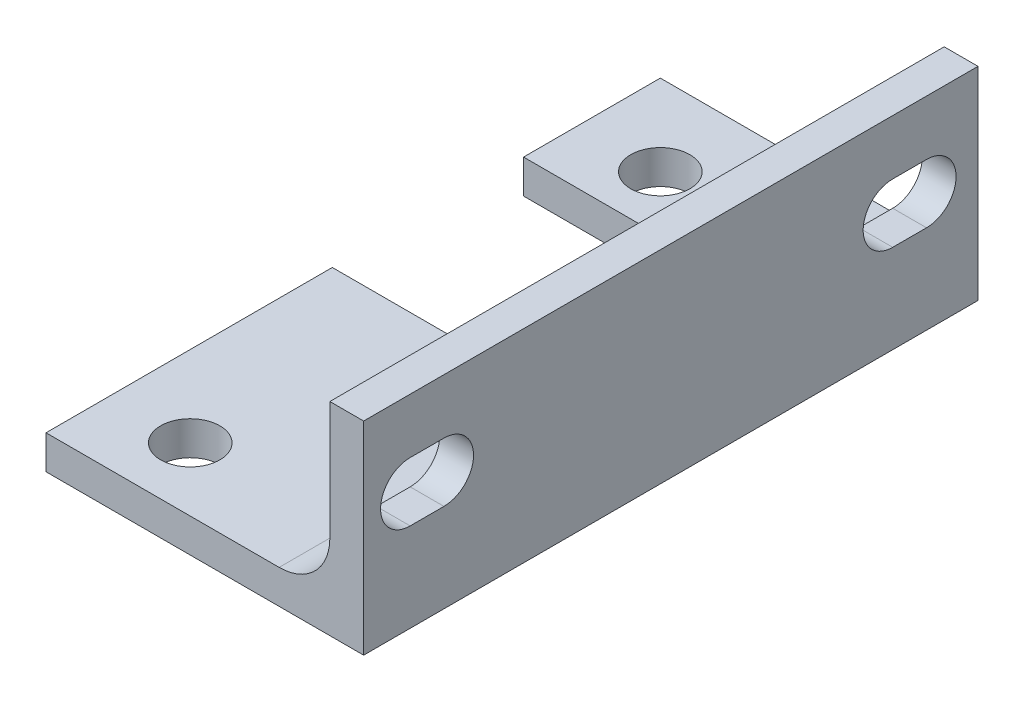
from build123d import *

# Parameters (mm, degrees)
SKETCH1_R           = 1.75
BOSS_EXTRUDE1_DEPTH = 2
SKETCH4_W           = 2
SKETCH4_H           = 36.35059407
BOSS_EXTRUDE3_DEPTH = 10
CUT_EXTRUDE1_DEPTH  = 10
FILLET1_R           = 3


with BuildPart() as part:
    # Sketch1 → Boss-Extrude1 (new body)
    with BuildSketch(Plane(origin=(0, 0, 0), x_dir=(1, 0, 0), z_dir=(0, 1, 0))):
        Polygon((5.603006234, 2.519255437), (16.866529546, 2.519255437), (16.866529546, 38.869849507), (4.37040298, 38.869849507), (-1.929271174, 38.869849507), (-1.929271174, 30.775756588), (6.866529546, 30.775756588), (6.866529546, 19.460556696), (-1.929271174, 19.460556696), (-1.929271174, 2.519255437), align=None)
        with Locations(Location((2.868105939, 34.070567936, 0), (0, 0, 270))):
            Circle(SKETCH1_R, mode=Mode.SUBTRACT)
        with Locations(Location((2.854801247, 6.270571119, 0), (0, 0, 270))):
            Circle(SKETCH1_R, mode=Mode.SUBTRACT)
    extrude(amount=BOSS_EXTRUDE1_DEPTH)

    # Sketch4 → Boss-Extrude3 (add)
    with BuildSketch(Plane(origin=(0, 2, 0), x_dir=(1, 0, 0), z_dir=(0, 1, 0))):
        with Locations((15.866529546, 20.694552472)):
            Rectangle(SKETCH4_W, SKETCH4_H)
    extrude(amount=BOSS_EXTRUDE3_DEPTH)

    # Sketch5 → Cut-Extrude1 (cut)
    with BuildSketch(Plane.ZY.offset(-14.866529546)):
        with BuildLine():
            Line((-5.270571119, 5.25), (-7.270571119, 5.25))
            ThreePointArc((-7.270571119, 5.25), (-9.020571119, 7), (-7.270571119, 8.75))
            Line((-7.270571119, 8.75), (-5.270571119, 8.75))
            ThreePointArc((-5.270571119, 8.75), (-3.520571119, 7), (-5.270571119, 5.25))
        make_face()
        with BuildLine():
            Line((-33.822803047, 5.25), (-35.822803047, 5.25))
            ThreePointArc((-35.822803047, 5.25), (-37.572803047, 7), (-35.822803047, 8.75))
            Line((-35.822803047, 8.75), (-33.822803047, 8.75))
            ThreePointArc((-33.822803047, 8.75), (-32.072803047, 7), (-33.822803047, 5.25))
        make_face()
    extrude(amount=-CUT_EXTRUDE1_DEPTH, mode=Mode.SUBTRACT)

    # Fillet1
    fillet1_edges = [part.edges().sort_by_distance(p)[0] for p in [
        (14.866529546, 2, -20.694552472),
    ]]
    fillet(fillet1_edges, radius=FILLET1_R)


solid = part.part
